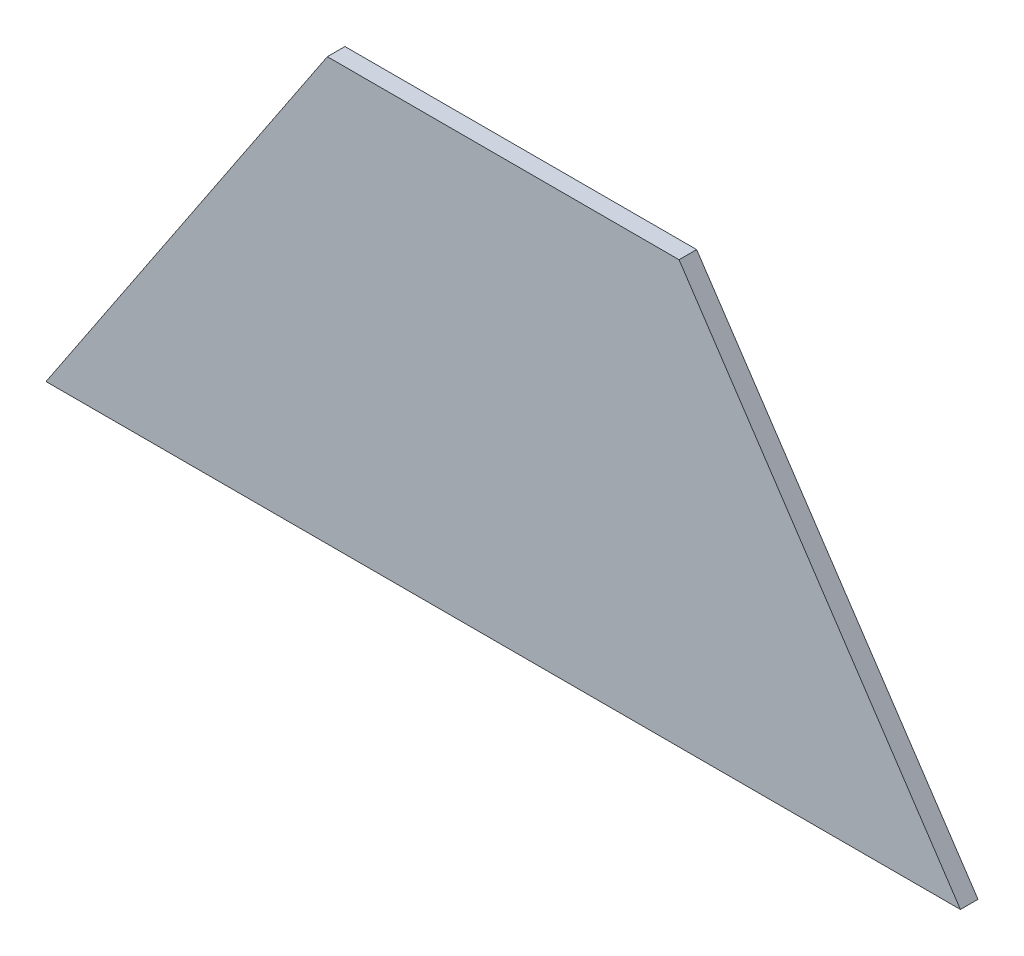
from build123d import *

# Parameters (mm, degrees)
BOSS_EXTRUDE1_DEPTH = 3.175


with BuildPart() as part:
    # Sketch1 → Boss-Extrude1 (new body)
    with BuildSketch(Plane.XY):
        Polygon((0, 0), (165.1, 0), (114.3, 76.2), (50.8, 76.2), align=None)
    extrude(amount=BOSS_EXTRUDE1_DEPTH)


solid = part.part
